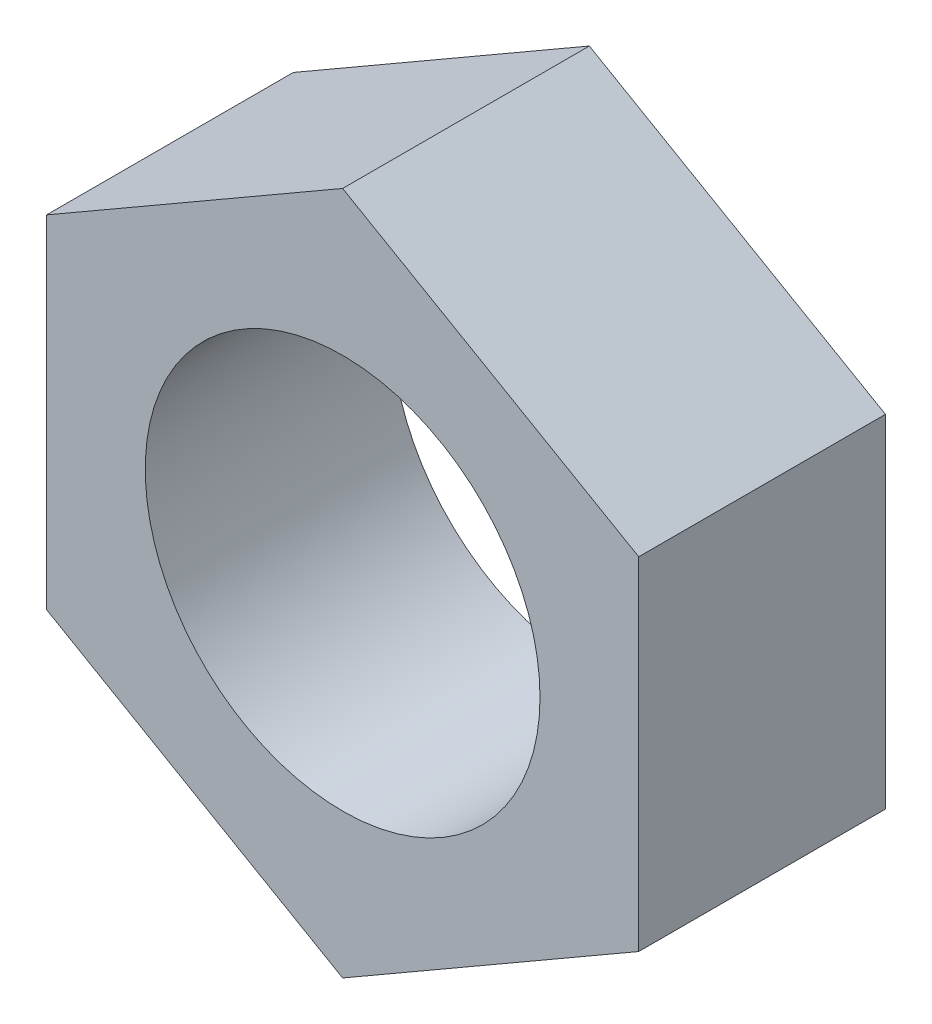
from build123d import *

# Parameters (mm, degrees)
SKETCH1_R      = 6.35
EXTRUDE1_DEPTH = 7.9375


with BuildPart() as part:
    # Sketch1 → Extrude1 (new body)
    with BuildSketch(Plane.XY):
        Polygon((-9.525, 5.499261314), (-9.525, -5.499261314), (0, -10.998522628), (9.525, -5.499261314), (9.525, 5.499261314), (0, 10.998522628), align=None)
        Circle(SKETCH1_R, mode=Mode.SUBTRACT)
    extrude(amount=EXTRUDE1_DEPTH)


solid = part.part
